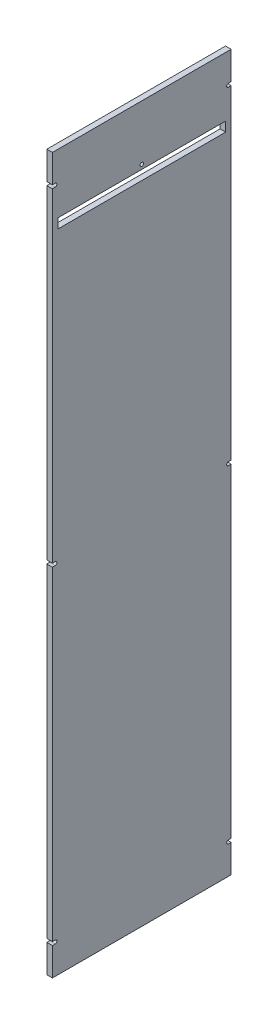
from build123d import *

# Parameters (mm, degrees)
SKETCH1_W             = 4.7625
SKETCH1_H             = 152.4
BOSS_EXTRUDE1_DEPTH   = 609.6
SKETCH2_W             = 142.875
SKETCH2_H             = 7.9375
CUT_EXTRUDE1_DEPTH    = 629.379345146
CUT_EXTRUDE2_DEPTH    = 629.379345146
F_4_CLEARANCE_HOLE1_D = 2.9464
SKETCH6_W             = 143.129
SKETCH6_H             = 8.1915
SKETCH6_W_2           = 142.875
SKETCH6_H_2           = 7.9375
CUT_EXTRUDE3_DEPTH    = 629.379345146


with BuildPart() as part:
    # Sketch1 → Boss-Extrude1 (new body)
    with BuildSketch(Plane(origin=(0, 0, 0), x_dir=(1, 0, 0), z_dir=(0, 1, 0))):
        with Locations((2.38125, 76.2)):
            Rectangle(SKETCH1_W, SKETCH1_H)
    extrude(amount=BOSS_EXTRUDE1_DEPTH)

    # Sketch2 → Cut-Extrude1 (cut, through all)
    with BuildSketch(Plane(origin=(4.7625, 0, 0), x_dir=(0, 0, -1), z_dir=(1, 0, 0))):
        with Locations((76.2, 554.83125)):
            Rectangle(SKETCH2_W, SKETCH2_H)
    extrude(amount=-CUT_EXTRUDE1_DEPTH, mode=Mode.SUBTRACT)

    # Sketch3 → Cut-Extrude2 (cut, through all)
    with BuildSketch(Plane.ZY):
        with BuildLine():
            Line((-2.38125, 582.7395), (0, 582.7395))
            Line((0, 582.7395), (0, 585.6605))
            Line((0, 585.6605), (-2.38125, 585.6605))
            ThreePointArc((-2.38125, 585.6605), (-3.84175, 584.2), (-2.38125, 582.7395))
        make_face()
        with BuildLine():
            Line((-150.01875, 585.6605), (-152.4, 585.6605))
            Line((-152.4, 585.6605), (-152.4, 582.7395))
            Line((-152.4, 582.7395), (-150.01875, 582.7395))
            ThreePointArc((-150.01875, 582.7395), (-148.55825, 584.2), (-150.01875, 585.6605))
        make_face()
        with BuildLine():
            Line((-150.01875, 303.3395), (-152.4, 303.3395))
            Line((-152.4, 303.3395), (-152.4, 306.2605))
            Line((-152.4, 306.2605), (-150.01875, 306.2605))
            ThreePointArc((-150.01875, 306.2605), (-148.55825, 304.8), (-150.01875, 303.3395))
        make_face()
        with BuildLine():
            Line((-2.38125, 303.3395), (0, 303.3395))
            Line((0, 303.3395), (0, 306.2605))
            Line((0, 306.2605), (-2.38125, 306.2605))
            ThreePointArc((-2.38125, 306.2605), (-3.84175, 304.8), (-2.38125, 303.3395))
        make_face()
        with BuildLine():
            Line((-2.38125, 23.9395), (0, 23.9395))
            Line((0, 23.9395), (0, 26.8605))
            Line((0, 26.8605), (-2.38125, 26.8605))
            ThreePointArc((-2.38125, 26.8605), (-3.84175, 25.4), (-2.38125, 23.9395))
        make_face()
        with BuildLine():
            Line((-150.01875, 23.9395), (-152.4, 23.9395))
            Line((-152.4, 23.9395), (-152.4, 26.8605))
            Line((-152.4, 26.8605), (-150.01875, 26.8605))
            ThreePointArc((-150.01875, 26.8605), (-148.55825, 25.4), (-150.01875, 23.9395))
        make_face()
    extrude(amount=-CUT_EXTRUDE2_DEPTH, mode=Mode.SUBTRACT)

    # #4 Clearance Hole1 (through all)
    with Locations(Plane.ZY):
        with Locations((-76.2, 562.76875)):
            Hole(F_4_CLEARANCE_HOLE1_D / 2)

    # Sketch6 → Cut-Extrude3 (cut, through all)
    with BuildSketch(Plane.ZY):
        with Locations((-76.2, 554.83125)):
            Rectangle(SKETCH6_W, SKETCH6_H)
        with Locations((-76.2, 554.83125)):
            Rectangle(SKETCH6_W_2, SKETCH6_H_2, mode=Mode.SUBTRACT)
    extrude(amount=-CUT_EXTRUDE3_DEPTH, mode=Mode.SUBTRACT)


solid = part.part
